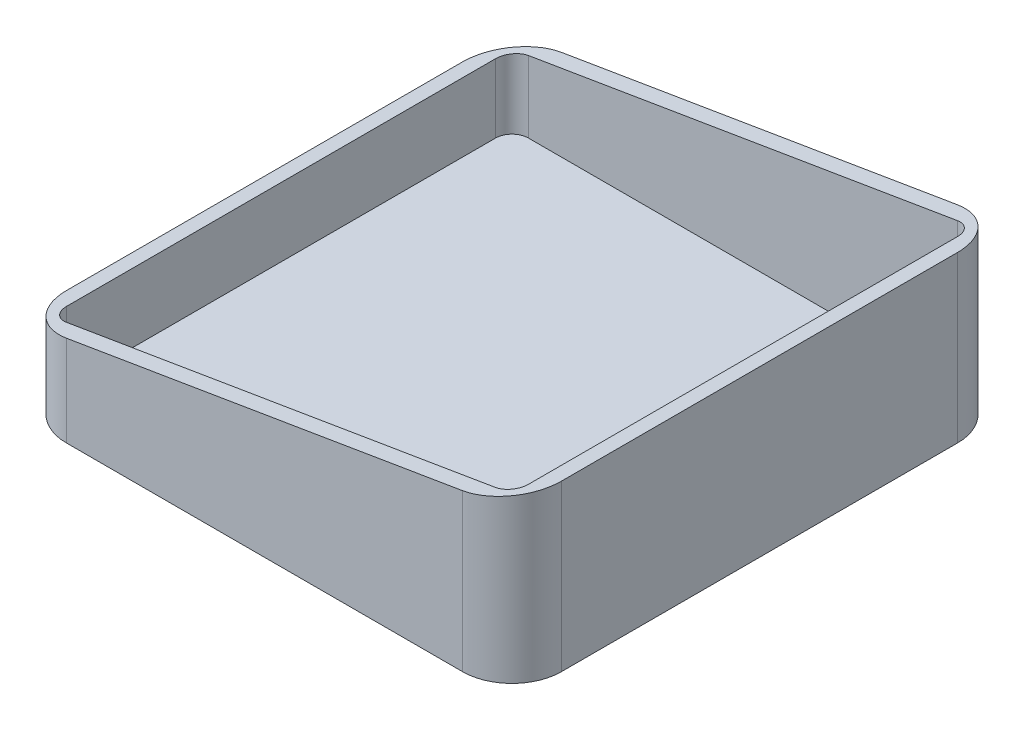
from build123d import *

# Parameters (mm, degrees)
BOSS_EXTRUDE1_DEPTH = 300
SHELL1_T            = -10
FILLET1_R           = 30
FILLET2_R           = 10


with BuildPart() as part:
    # Sketch1 → Boss-Extrude1 (new body)
    with BuildSketch(Plane.XY):
        Polygon((-150, -16.621621622), (150, -16.621621622), (150, 83.378378378), (-150, 33.378378378), align=None)
    extrude(amount=BOSS_EXTRUDE1_DEPTH)

    # Shell1
    shell1_openings = [part.faces().sort_by_distance(p)[0] for p in [
        (0, 58.378378378, 150),
    ]]
    offset(amount=SHELL1_T, openings=shell1_openings, kind=Kind.INTERSECTION)

    # Fillet1
    fillet1_edges = [part.edges().sort_by_distance(p)[0] for p in [
        (150, 33.378378378, 300),
        (-150, 8.378378378, 300),
        (150, 33.378378378, 0),
        (-150, 8.378378378, 0),
    ]]
    fillet(fillet1_edges, radius=FILLET1_R)

    # Fillet2
    fillet2_edges = [part.edges().sort_by_distance(p)[0] for p in [
        (-140, 14.211711712, 10),
        (140, 37.545045045, 10),
        (-140, 14.211711712, 290),
        (140, 37.545045045, 290),
    ]]
    fillet(fillet2_edges, radius=FILLET2_R)


solid = part.part
